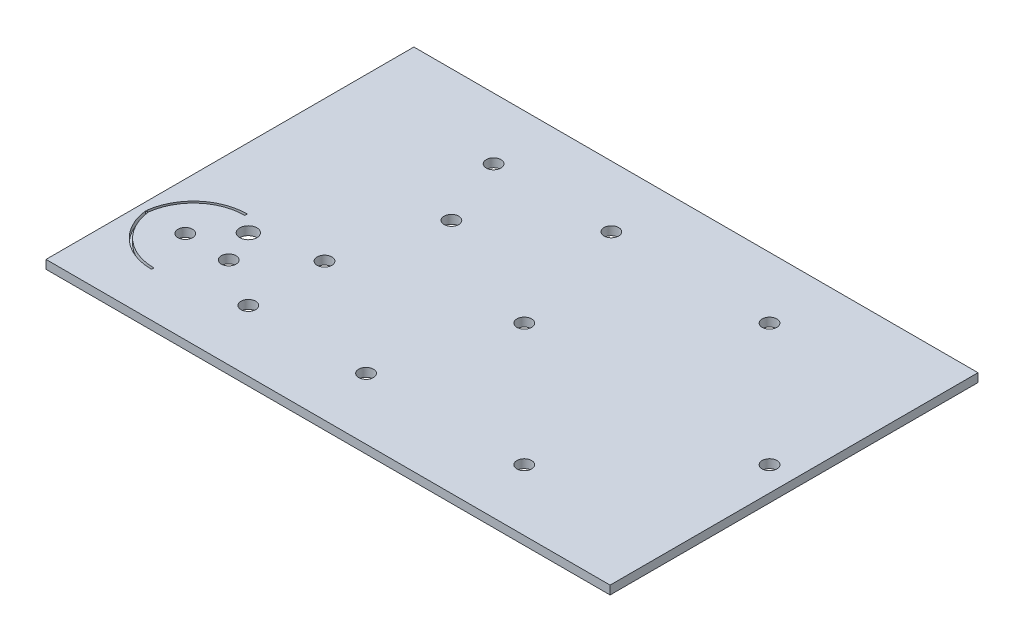
from build123d import *

# Parameters (mm, degrees)
SKETCH_1_W           = 250
SKETCH_1_H           = 150
EXTRUDE_1_DEPTH      = 5
SKETCH_1_4_R         = 3
CUT_EXTRUDE_1_DEPTH  = 5
SKETCH_1_5_R         = 3
CUT_EXTRUDE_2_DEPTH  = 5
SKETCH_1_6_R         = 3
CUT_EXTRUDE_3_DEPTH  = 5
SKETCH_1_7_R         = 3
CUT_EXTRUDE_4_DEPTH  = 5
SKETCH_2_R           = 3
CUT_EXTRUDE_5_DEPTH  = 5
SKETCH_3_R           = 3
CUT_EXTRUDE_6_DEPTH  = 45
SKETCH_3_3_R         = 3.5
CUT_EXTRUDE_7_DEPTH  = 45
SKETCH_4_R           = 3
CUT_EXTRUDE_8_DEPTH  = 5
SKETCH_4_3_R         = 3
CUT_EXTRUDE_9_DEPTH  = 5
SKETCH_5_R           = 3
CUT_EXTRUDE_10_DEPTH = 5
SKETCH_6_W           = 250
SKETCH_6_H           = 150
SKETCH_6_R           = 3
SKETCH_6_R_2         = 3.5
CUT_EXTRUDE_11_DEPTH = 1.5
SKETCH_7_R           = 3
CUT_EXTRUDE_12_DEPTH = 205.296965225
SKETCH_8_W           = 82.621849766
SKETCH_8_H           = 181.309059209
CUT_EXTRUDE_13_DEPTH = 10
CUT_EXTRUDE_14_DEPTH = 2


with BuildPart() as part:
    # 草圖1 → 填料-伸長1 (new body)
    with BuildSketch(Plane(origin=(0, 0, 0), x_dir=(1, 0, 0), z_dir=(0, 1, 0))):
        with Locations((-65, 0)):
            Rectangle(SKETCH_1_W, SKETCH_1_H)
    extrude(amount=-EXTRUDE_1_DEPTH)

    # 草圖1<4> → 除料-伸長1 (cut)
    with BuildSketch(Plane(origin=(0, 0, 0), x_dir=(1, 0, 0), z_dir=(0, 1, 0))):
        with Locations((0, 50)):
            Circle(SKETCH_1_4_R)
    extrude(amount=-CUT_EXTRUDE_1_DEPTH, mode=Mode.SUBTRACT)

    # 草圖1<5> → 除料-伸長2 (cut)
    with BuildSketch(Plane(origin=(0, 0, 0), x_dir=(1, 0, 0), z_dir=(0, 1, 0))):
        with Locations((-50, 0)):
            Circle(SKETCH_1_5_R)
    extrude(amount=-CUT_EXTRUDE_2_DEPTH, mode=Mode.SUBTRACT)

    # 草圖1<6> → 除料-伸長3 (cut)
    with BuildSketch(Plane(origin=(0, 0, 0), x_dir=(1, 0, 0), z_dir=(0, 1, 0))):
        with Locations((0, -50)):
            Circle(SKETCH_1_6_R)
    extrude(amount=-CUT_EXTRUDE_3_DEPTH, mode=Mode.SUBTRACT)

    # 草圖1<7> → 除料-伸長4 (cut)
    with BuildSketch(Plane(origin=(0, 0, 0), x_dir=(1, 0, 0), z_dir=(0, 1, 0))):
        with Locations((50, 0)):
            Circle(SKETCH_1_7_R)
    extrude(amount=-CUT_EXTRUDE_4_DEPTH, mode=Mode.SUBTRACT)

    # 草圖2 → 除料-伸長5 (cut)
    with BuildSketch(Plane(origin=(0, 0, 0), x_dir=(1, 0, 0), z_dir=(0, 1, 0))):
        with Locations((-150.76, -37.46)):
            Circle(SKETCH_2_R)
    extrude(amount=-CUT_EXTRUDE_5_DEPTH, mode=Mode.SUBTRACT)

    # 草圖3 → 除料-伸長6 (cut)
    with BuildSketch(Plane(origin=(0, 0, 0), x_dir=(1, 0, 0), z_dir=(0, 1, 0))):
        with Locations((-132.57, -37.93)):
            Circle(SKETCH_3_R)
    extrude(amount=-CUT_EXTRUDE_6_DEPTH, mode=Mode.SUBTRACT)

    # 草圖3<3> → 除料-伸長7 (cut)
    with BuildSketch(Plane(origin=(0, 0, 0), x_dir=(1, 0, 0), z_dir=(0, 1, 0))):
        with Locations((-138.16, -24.34)):
            Circle(SKETCH_3_3_R)
    extrude(amount=-CUT_EXTRUDE_7_DEPTH, mode=Mode.SUBTRACT)

    # 草圖4 → 除料-伸長8 (cut)
    with BuildSketch(Plane(origin=(0, 0, 0), x_dir=(1, 0, 0), z_dir=(0, 1, 0))):
        with Locations((-112.5, -50)):
            Circle(SKETCH_4_R)
    extrude(amount=-CUT_EXTRUDE_8_DEPTH, mode=Mode.SUBTRACT)

    # 草圖4<3> → 除料-伸長9 (cut)
    with BuildSketch(Plane(origin=(0, 0, 0), x_dir=(1, 0, 0), z_dir=(0, 1, 0))):
        with Locations((-64.5, -50)):
            Circle(SKETCH_4_3_R)
    extrude(amount=-CUT_EXTRUDE_9_DEPTH, mode=Mode.SUBTRACT)

    # 草圖5 → 除料-伸長10 (cut)
    with BuildSketch(Plane(origin=(0, 0, 0), x_dir=(1, 0, 0), z_dir=(0, 1, 0))):
        with Locations((-112.61, -18.84)):
            Circle(SKETCH_5_R)
        with Locations((-101.14, 21.42)):
            Circle(SKETCH_5_R)
    extrude(amount=-CUT_EXTRUDE_10_DEPTH, mode=Mode.SUBTRACT)

    # 草圖6 → 除料-伸長11 (cut)
    with BuildSketch(Plane(origin=(0, 0, 0), x_dir=(1, 0, 0), z_dir=(0, 1, 0))):
        with Locations((-65, 0)):
            Rectangle(SKETCH_6_W, SKETCH_6_H)
        with Locations((-150.76, -37.46)):
            Circle(SKETCH_6_R, mode=Mode.SUBTRACT)
        with Locations((-138.16, -24.34)):
            Circle(SKETCH_6_R_2, mode=Mode.SUBTRACT)
        with Locations((-132.57, -37.93)):
            Circle(SKETCH_6_R, mode=Mode.SUBTRACT)
        with Locations((-112.61, -18.84)):
            Circle(SKETCH_6_R, mode=Mode.SUBTRACT)
        with Locations((-112.5, -50)):
            Circle(SKETCH_6_R, mode=Mode.SUBTRACT)
        with Locations((-101.14, 21.42)):
            Circle(SKETCH_6_R, mode=Mode.SUBTRACT)
        with Locations((-50, 0)):
            Circle(SKETCH_6_R, mode=Mode.SUBTRACT)
        with Locations((-64.5, -50)):
            Circle(SKETCH_6_R, mode=Mode.SUBTRACT)
        with Locations((0, 50)):
            Circle(SKETCH_6_R, mode=Mode.SUBTRACT)
        with Locations((0, -50)):
            Circle(SKETCH_6_R, mode=Mode.SUBTRACT)
        with Locations((50, 0)):
            Circle(SKETCH_6_R, mode=Mode.SUBTRACT)
    extrude(amount=-CUT_EXTRUDE_11_DEPTH, mode=Mode.SUBTRACT)

    # 草圖7 → 除料-伸長12 (cut, through all)
    with BuildSketch(Plane(origin=(0, -1.5, 0), x_dir=(1, 0, 0), z_dir=(0, 1, 0))):
        with Locations((-64.5, 50)):
            Circle(SKETCH_7_R)
        with Locations((-112.5, 50)):
            Circle(SKETCH_7_R)
        with Locations((-64.5, -50)):
            Circle(SKETCH_7_R)
        with Locations((-112.5, -50)):
            Circle(SKETCH_7_R)
    extrude(amount=-CUT_EXTRUDE_12_DEPTH, mode=Mode.SUBTRACT)

    # 草圖8 → 除料-伸長13 (cut)
    with BuildSketch(Plane(origin=(0, -1.5, 0), x_dir=(1, 0, 0), z_dir=(0, 1, 0))):
        with Locations((-211.310924883, 0.092792435)):
            Rectangle(SKETCH_8_W, SKETCH_8_H)
    extrude(amount=-CUT_EXTRUDE_13_DEPTH, mode=Mode.SUBTRACT)

    # 草圖11 → 除料-伸長14 (cut)
    with BuildSketch(Plane(origin=(0, -1.5, 0), x_dir=(1, 0, 0), z_dir=(0, 1, 0))):
        with BuildLine():
            Line((-165.849119967, -37.512806521), (-166.841935203, -37.632463975))
            ThreePointArc((-166.841935203, -37.632463975), (-159.595989048, -51.4607747), (-145, -57))
            Line((-145, -57), (-145, -56))
            ThreePointArc((-145, -56), (-158.932535, -50.712557668), (-165.849119967, -37.512806521))
        make_face()
    cut_extrude_14 = extrude(amount=-CUT_EXTRUDE_14_DEPTH, mode=Mode.SUBTRACT)

    # 鏡射1: 除料-伸長14 across plane
    add(cut_extrude_14.mirror(Plane.XY.offset(37.46)), mode=Mode.SUBTRACT)


solid = part.part
